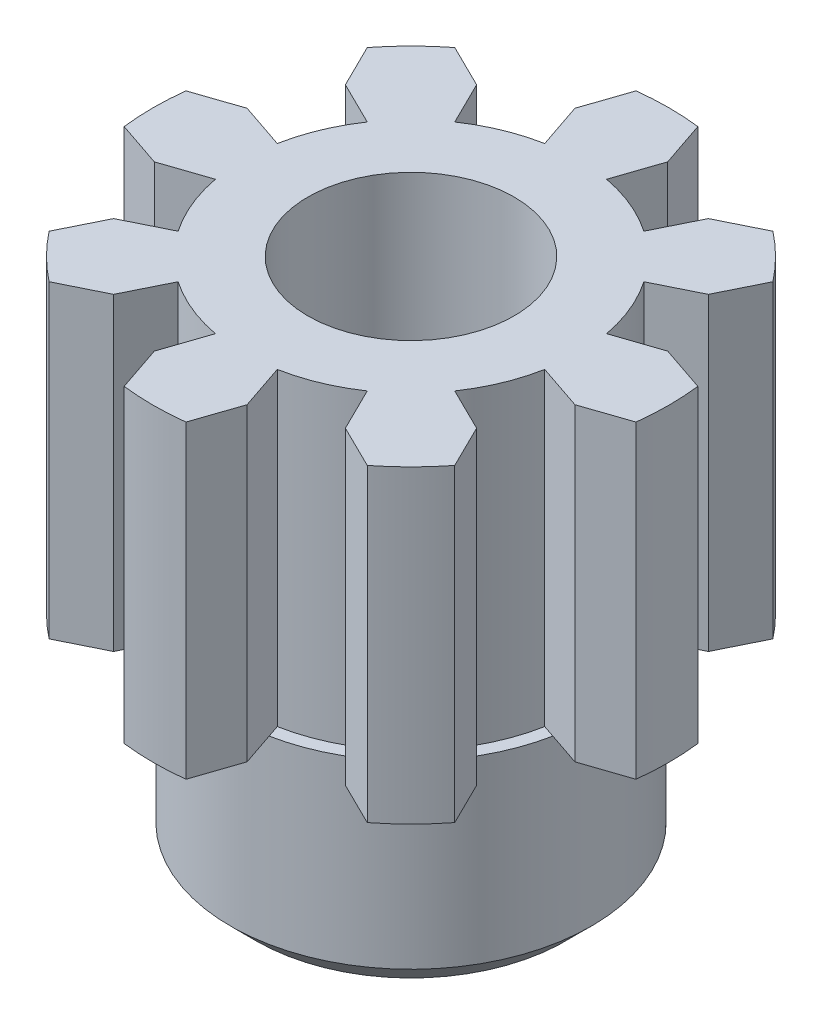
from build123d import *

# Parameters (mm, degrees)
ESBO_O1_W                  = 2.5
ESBO_O1_H                  = 3
CORTE_EXTRUS_O1_DEPTH      = 5.636809248
CORTE_EXTRUS_O2_DEPTH      = 5.636809248
CORTE_EXTRUS_O3_DEPTH      = 5.636809248
CORTE_EXTRUS_O4_DEPTH      = 5.636809248
CORTE_EXTRUS_O5_DEPTH      = 5.636809248
CORTE_EXTRUS_O6_DEPTH      = 5.636809248
CORTE_EXTRUS_O7_DEPTH      = 5.636809248
CORTE_EXTRUS_O8_DEPTH      = 5.636809248
CORTE_EXTRUS_O9_DEPTH      = 5.636809248
CORTE_EXTRUS_O10_DEPTH     = 5.636809248
CORTE_EXTRUS_O11_DEPTH     = 5.636809248
CORTE_EXTRUS_O12_DEPTH     = 5.636809248
CORTE_EXTRUS_O13_DEPTH     = 5.636809248
CORTE_EXTRUS_O14_DEPTH     = 5.636809248
CORTE_EXTRUS_O15_DEPTH     = 5.636809248
CORTE_EXTRUS_O16_DEPTH     = 5.636809248
ESBO_O18_R                 = 1.75
RESSALTO_EXTRUS_O1_DEPTH   = 2
FURO_DE_DI_METRO_2_0_2_1_D = 2
CHANFRO1_SIZE              = 0.25


with BuildPart() as part:
    # Esboço1 → Revolução1 (revolve)
    with BuildSketch(Plane.XY, mode=Mode.PRIVATE) as revolu_o1_sk:
        with Locations((1.25, 1.5)):
            Rectangle(ESBO_O1_W, ESBO_O1_H)
    revolve(revolu_o1_sk.sketch.rotate(Axis((0, 3, 0), (0, -1, 0)), 270), axis=Axis((0, 3, 0), (0, -1, 0)))

    # Esboço2 → Corte-extrusão1 (cut, through all)
    with BuildSketch(Plane.XZ):
        with BuildLine():
            Line((-0.3, -2.481934729), (-0.62769311, -1.515385219))
            Line((-0.62769311, -1.515385219), (-1.542860843, -1.967124912))
            ThreePointArc((-1.542860843, -1.967124912), (-0.956708581, -2.309698831), (-0.3, -2.481934729))
        make_face()
    extrude(amount=-CORTE_EXTRUS_O1_DEPTH, mode=Mode.SUBTRACT)

    # Esboço3 → Corte-extrusão2 (cut, through all)
    with BuildSketch(Plane.XZ):
        with BuildLine():
            Line((-0.917165314, -1.341429382), (-1.123947061, -1.760343164))
            Line((-1.123947061, -1.760343164), (-0.62769311, -1.515385219))
            Line((-0.62769311, -1.515385219), (-0.45, -2.039501177))
            Line((-0.45, -2.039501177), (-0.3, -1.597067625))
            ThreePointArc((-0.3, -1.597067625), (-0.621860578, -1.50130424), (-0.917165314, -1.341429382))
        make_face()
    extrude(amount=-CORTE_EXTRUS_O2_DEPTH, mode=Mode.SUBTRACT)

    # Esboço4 → Corte-extrusão3 (cut, through all)
    with BuildSketch(Plane.XZ):
        with BuildLine():
            Line((-1.967124912, -1.542860843), (-1.515385219, -0.62769311))
            Line((-1.515385219, -0.62769311), (-2.481934729, -0.3))
            ThreePointArc((-2.481934729, -0.3), (-2.309698831, -0.956708581), (-1.967124912, -1.542860843))
        make_face()
    extrude(amount=-CORTE_EXTRUS_O3_DEPTH, mode=Mode.SUBTRACT)

    # Esboço5 → Corte-extrusão4 (cut, through all)
    with BuildSketch(Plane.XZ):
        with BuildLine():
            Line((-1.597067625, -0.3), (-2.039501177, -0.45))
            Line((-2.039501177, -0.45), (-1.515385219, -0.62769311))
            Line((-1.515385219, -0.62769311), (-1.760343164, -1.123947061))
            Line((-1.760343164, -1.123947061), (-1.341429382, -0.917165314))
            ThreePointArc((-1.341429382, -0.917165314), (-1.50130424, -0.621860578), (-1.597067625, -0.3))
        make_face()
    extrude(amount=-CORTE_EXTRUS_O4_DEPTH, mode=Mode.SUBTRACT)

    # Esboço6 → Corte-extrusão5 (cut, through all)
    with BuildSketch(Plane.XZ):
        with BuildLine():
            Line((-2.481934729, 0.3), (-1.515385219, 0.62769311))
            Line((-1.515385219, 0.62769311), (-1.967124912, 1.542860843))
            ThreePointArc((-1.967124912, 1.542860843), (-2.309698831, 0.956708581), (-2.481934729, 0.3))
        make_face()
    extrude(amount=-CORTE_EXTRUS_O5_DEPTH, mode=Mode.SUBTRACT)

    # Esboço7 → Corte-extrusão6 (cut, through all)
    with BuildSketch(Plane.XZ):
        with BuildLine():
            Line((-1.341429382, 0.917165314), (-1.760343164, 1.123947061))
            Line((-1.760343164, 1.123947061), (-1.515385219, 0.62769311))
            Line((-1.515385219, 0.62769311), (-2.039501177, 0.45))
            Line((-2.039501177, 0.45), (-1.597067625, 0.3))
            ThreePointArc((-1.597067625, 0.3), (-1.50130424, 0.621860578), (-1.341429382, 0.917165314))
        make_face()
    extrude(amount=-CORTE_EXTRUS_O6_DEPTH, mode=Mode.SUBTRACT)

    # Esboço8 → Corte-extrusão7 (cut, through all)
    with BuildSketch(Plane.XZ):
        with BuildLine():
            Line((-1.542860843, 1.967124912), (-0.62769311, 1.515385219))
            Line((-0.62769311, 1.515385219), (-0.3, 2.481934729))
            ThreePointArc((-0.3, 2.481934729), (-0.956708581, 2.309698831), (-1.542860843, 1.967124912))
        make_face()
    extrude(amount=-CORTE_EXTRUS_O7_DEPTH, mode=Mode.SUBTRACT)

    # Esboço9 → Corte-extrusão8 (cut, through all)
    with BuildSketch(Plane.XZ):
        with BuildLine():
            Line((-0.3, 1.597067625), (-0.45, 2.039501177))
            Line((-0.45, 2.039501177), (-0.62769311, 1.515385219))
            Line((-0.62769311, 1.515385219), (-1.123947061, 1.760343164))
            Line((-1.123947061, 1.760343164), (-0.917165314, 1.341429382))
            ThreePointArc((-0.917165314, 1.341429382), (-0.621860578, 1.50130424), (-0.3, 1.597067625))
        make_face()
    extrude(amount=-CORTE_EXTRUS_O8_DEPTH, mode=Mode.SUBTRACT)

    # Esboço10 → Corte-extrusão9 (cut, through all)
    with BuildSketch(Plane.XZ):
        with BuildLine():
            Line((0.3, 2.481934729), (0.62769311, 1.515385219))
            Line((0.62769311, 1.515385219), (1.542860843, 1.967124912))
            ThreePointArc((1.542860843, 1.967124912), (0.956708581, 2.309698831), (0.3, 2.481934729))
        make_face()
    extrude(amount=-CORTE_EXTRUS_O9_DEPTH, mode=Mode.SUBTRACT)

    # Esboço11 → Corte-extrusão10 (cut, through all)
    with BuildSketch(Plane.XZ):
        with BuildLine():
            Line((0.917165314, 1.341429382), (1.123947061, 1.760343164))
            Line((1.123947061, 1.760343164), (0.62769311, 1.515385219))
            Line((0.62769311, 1.515385219), (0.45, 2.039501177))
            Line((0.45, 2.039501177), (0.3, 1.597067625))
            ThreePointArc((0.3, 1.597067625), (0.621860578, 1.50130424), (0.917165314, 1.341429382))
        make_face()
    extrude(amount=-CORTE_EXTRUS_O10_DEPTH, mode=Mode.SUBTRACT)

    # Esboço12 → Corte-extrusão11 (cut, through all)
    with BuildSketch(Plane.XZ):
        with BuildLine():
            Line((1.967124912, 1.542860843), (1.515385219, 0.62769311))
            Line((1.515385219, 0.62769311), (2.481934729, 0.3))
            ThreePointArc((2.481934729, 0.3), (2.309698831, 0.956708581), (1.967124912, 1.542860843))
        make_face()
    extrude(amount=-CORTE_EXTRUS_O11_DEPTH, mode=Mode.SUBTRACT)

    # Esboço13 → Corte-extrusão12 (cut, through all)
    with BuildSketch(Plane.XZ):
        with BuildLine():
            Line((1.597067625, 0.3), (2.039501177, 0.45))
            Line((2.039501177, 0.45), (1.515385219, 0.62769311))
            Line((1.515385219, 0.62769311), (1.760343164, 1.123947061))
            Line((1.760343164, 1.123947061), (1.341429382, 0.917165314))
            ThreePointArc((1.341429382, 0.917165314), (1.50130424, 0.621860578), (1.597067625, 0.3))
        make_face()
    extrude(amount=-CORTE_EXTRUS_O12_DEPTH, mode=Mode.SUBTRACT)

    # Esboço14 → Corte-extrusão13 (cut, through all)
    with BuildSketch(Plane.XZ):
        with BuildLine():
            Line((2.481934729, -0.3), (1.515385219, -0.62769311))
            Line((1.515385219, -0.62769311), (1.967124912, -1.542860843))
            ThreePointArc((1.967124912, -1.542860843), (2.309698831, -0.956708581), (2.481934729, -0.3))
        make_face()
    extrude(amount=-CORTE_EXTRUS_O13_DEPTH, mode=Mode.SUBTRACT)

    # Esboço15 → Corte-extrusão14 (cut, through all)
    with BuildSketch(Plane.XZ):
        with BuildLine():
            Line((1.341429382, -0.917165314), (1.760343164, -1.123947061))
            Line((1.760343164, -1.123947061), (1.515385219, -0.62769311))
            Line((1.515385219, -0.62769311), (2.039501177, -0.45))
            Line((2.039501177, -0.45), (1.597067625, -0.3))
            ThreePointArc((1.597067625, -0.3), (1.50130424, -0.621860578), (1.341429382, -0.917165314))
        make_face()
    extrude(amount=-CORTE_EXTRUS_O14_DEPTH, mode=Mode.SUBTRACT)

    # Esboço16 → Corte-extrusão15 (cut, through all)
    with BuildSketch(Plane.XZ):
        with BuildLine():
            Line((1.542860843, -1.967124912), (0.62769311, -1.515385219))
            Line((0.62769311, -1.515385219), (0.3, -2.481934729))
            ThreePointArc((0.3, -2.481934729), (0.956708581, -2.309698831), (1.542860843, -1.967124912))
        make_face()
    extrude(amount=-CORTE_EXTRUS_O15_DEPTH, mode=Mode.SUBTRACT)

    # Esboço17 → Corte-extrusão16 (cut, through all)
    with BuildSketch(Plane.XZ):
        with BuildLine():
            Line((0.62769311, -1.515385219), (1.123947061, -1.760343164))
            Line((1.123947061, -1.760343164), (0.917165314, -1.341429382))
            ThreePointArc((0.917165314, -1.341429382), (0.621860578, -1.50130424), (0.3, -1.597067625))
            Line((0.3, -1.597067625), (0.45, -2.039501177))
            Line((0.45, -2.039501177), (0.62769311, -1.515385219))
        make_face()
    extrude(amount=-CORTE_EXTRUS_O16_DEPTH, mode=Mode.SUBTRACT)

    # Esboço18 → Ressalto-extrusão1 (add)
    with BuildSketch(Plane.XZ):
        with Locations(Location((0, 0, 0), (0, 0, 78.779993889))):
            Circle(ESBO_O18_R)
    extrude(amount=RESSALTO_EXTRUS_O1_DEPTH)

    # Furo de diâmetro Ø2.0 (2)1 (through all)
    with Locations(Plane(origin=(0, 3, 0), x_dir=(1, 0, 0), z_dir=(0, 1, 0))):
        with Locations((0, 0)):
            Hole(FURO_DE_DI_METRO_2_0_2_1_D / 2)

    # Chanfro1
    chanfro1_edges = [part.edges().sort_by_distance(p)[0] for p in [
        (-0.340509508, -2, -1.71655273),
    ]]
    chamfer(chanfro1_edges, length=CHANFRO1_SIZE)


solid = part.part
